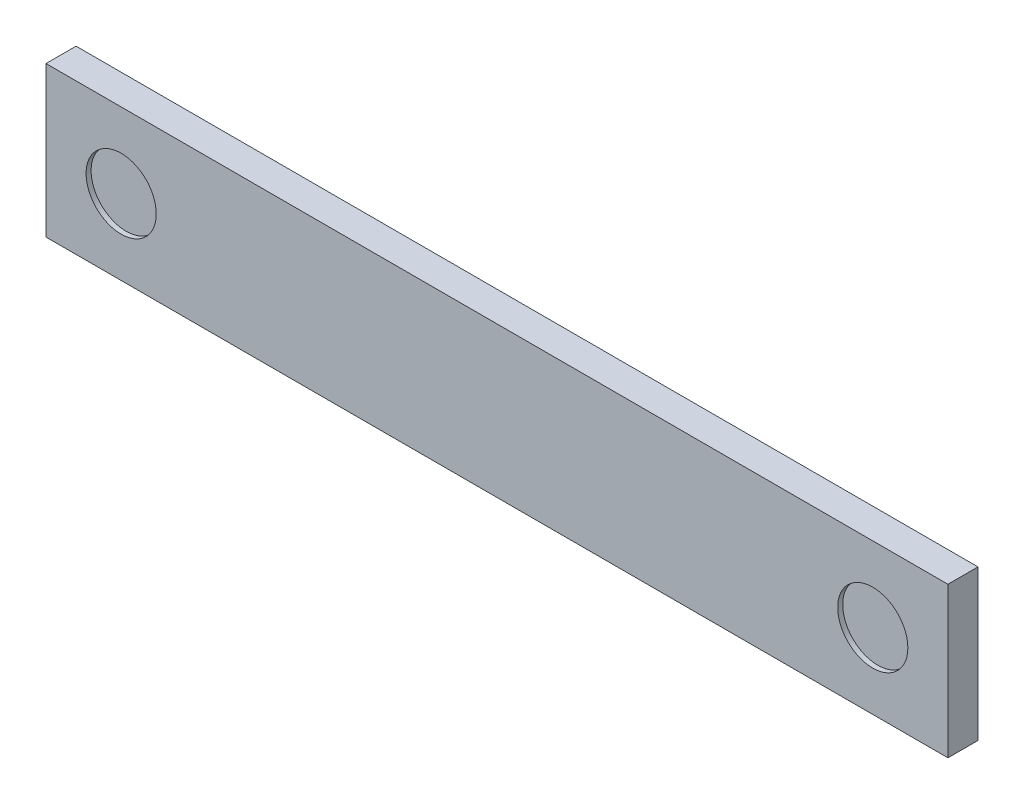
from build123d import *

# Parameters (mm, degrees)
ESQUISSE1_W             = 1800
ESQUISSE1_H             = 300
BOSS_EXTRU_1_DEPTH      = 60
ESQUISSE2_R             = 70
ENL_V_MAT_EXTRU_1_DEPTH = 10


with BuildPart() as part:
    # Esquisse1 → Boss.-Extru.1 (new body)
    with BuildSketch(Plane.XY):
        with Locations((-900, 150)):
            Rectangle(ESQUISSE1_W, ESQUISSE1_H)
    extrude(amount=BOSS_EXTRU_1_DEPTH)

    # Esquisse2 → Enlèv. mat.-Extru.1 (cut)
    with BuildSketch(Plane.XY.offset(60)):
        with Locations((-150, 150)):
            Circle(ESQUISSE2_R)
        with Locations((-1650, 150)):
            Circle(ESQUISSE2_R)
    extrude(amount=-ENL_V_MAT_EXTRU_1_DEPTH, mode=Mode.SUBTRACT)


solid = part.part
